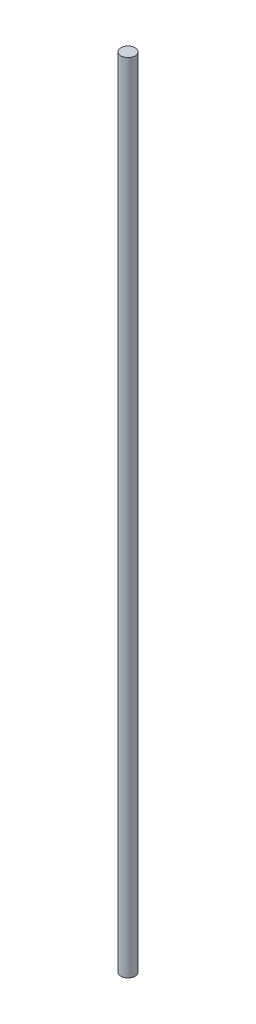
from build123d import *

# Parameters (mm, degrees)
SKETCH1_R           = 4
BOSS_EXTRUDE1_DEPTH = 450


with BuildPart() as part:
    # Sketch1 → Boss-Extrude1 (new body)
    with BuildSketch(Plane(origin=(0, 0, 0), x_dir=(1, 0, 0), z_dir=(0, 1, 0))):
        with Locations(Location((0, 0, 0), (0, 0, 270))):
            Circle(SKETCH1_R)
    extrude(amount=BOSS_EXTRUDE1_DEPTH)


solid = part.part
